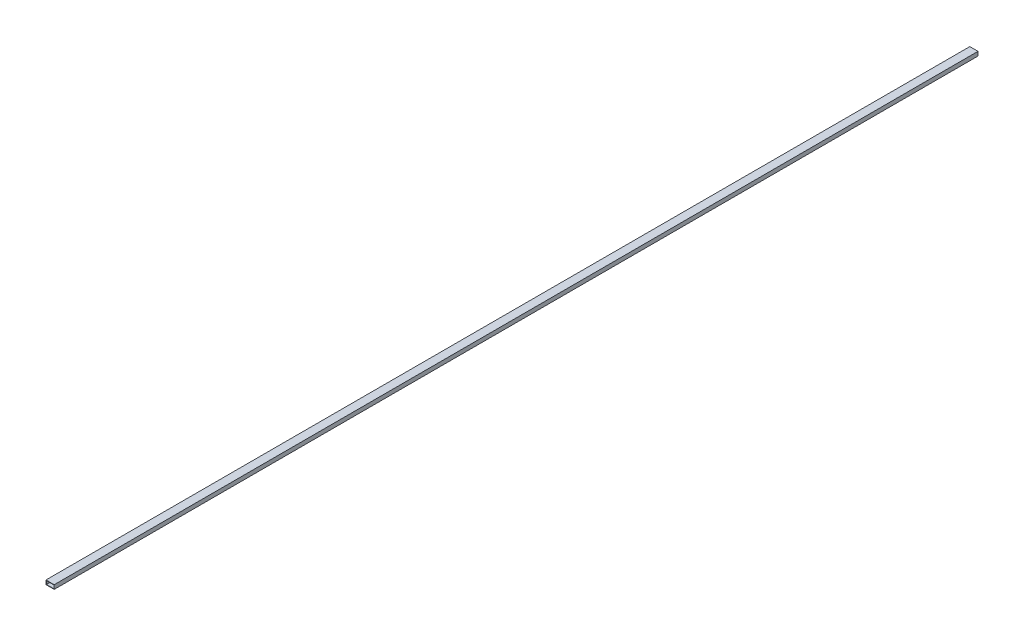
from build123d import *

# Parameters (mm, degrees)
SKETCH_1_W      = 20
SKETCH_1_H      = 10
SKETCH_1_W_2    = 18
SKETCH_1_H_2    = 8
EXTRUDE_1_DEPTH = 2250


with BuildPart() as part:
    # 草图1 → 凸台-拉伸1 (new body)
    with BuildSketch(Plane.XY):
        with Locations((10, 5)):
            Rectangle(SKETCH_1_W, SKETCH_1_H)
        with Locations((10, 5)):
            Rectangle(SKETCH_1_W_2, SKETCH_1_H_2, mode=Mode.SUBTRACT)
    extrude(amount=EXTRUDE_1_DEPTH)


solid = part.part
